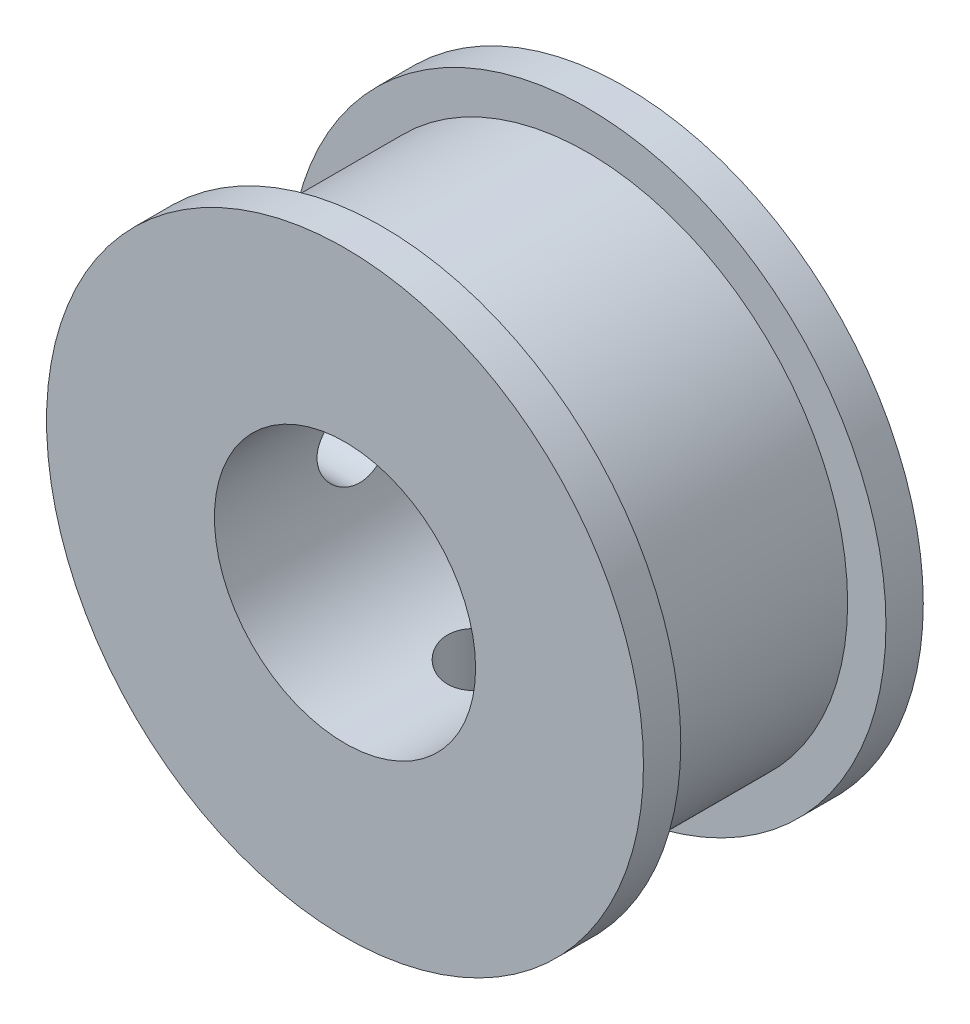
from build123d import *

# Parameters (mm, degrees)
SKETCH_1_R          = 16
EXTRUDE_1_DEPTH     = 2
SKETCH_2_R          = 13.945
EXTRUDE_2_DEPTH     = 11
SKETCH_3_R          = 16
EXTRUDE_3_DEPTH     = 2
SKETCH_4_R          = 7
CUT_EXTRUDE_1_DEPTH = 15
SKETCH_5_R          = 2
CUT_EXTRUDE_2_DEPTH = 20
SKETCH_8_R          = 2
CUT_EXTRUDE_3_DEPTH = 20


with BuildPart() as part:
    # 草图1 → 凸台-拉伸1 (new body)
    with BuildSketch(Plane.XY):
        Circle(SKETCH_1_R)
    extrude(amount=EXTRUDE_1_DEPTH)

    # 草图2 → 凸台-拉伸2 (add)
    with BuildSketch(Plane.XY.offset(2)):
        Circle(SKETCH_2_R)
    extrude(amount=EXTRUDE_2_DEPTH)

    # 草图3 → 凸台-拉伸3 (add)
    with BuildSketch(Plane.XY.offset(13)):
        Circle(SKETCH_3_R)
    extrude(amount=EXTRUDE_3_DEPTH)

    # 草图4 → 切除-拉伸1 (cut)
    with BuildSketch(Plane.XY.offset(15)):
        Circle(SKETCH_4_R)
    extrude(amount=-CUT_EXTRUDE_1_DEPTH, mode=Mode.SUBTRACT)

    # 草图5 → 切除-拉伸2 (cut)
    with BuildSketch(Plane(origin=(0, 0, 0), x_dir=(1, 0, 0), z_dir=(0, 1, 0))):
        with Locations(Location((0, -7.5, 0), (0, 0, 270))):
            Circle(SKETCH_5_R)
    extrude(amount=-CUT_EXTRUDE_2_DEPTH, mode=Mode.SUBTRACT)

    # 草图8 → 切除-拉伸3 (cut)
    with BuildSketch(Plane(origin=(0, 0, 0), x_dir=(0, 0, -1), z_dir=(1, 0, 0))):
        with Locations((-7.5, 0)):
            Circle(SKETCH_8_R)
    extrude(amount=-CUT_EXTRUDE_3_DEPTH, mode=Mode.SUBTRACT)


solid = part.part
